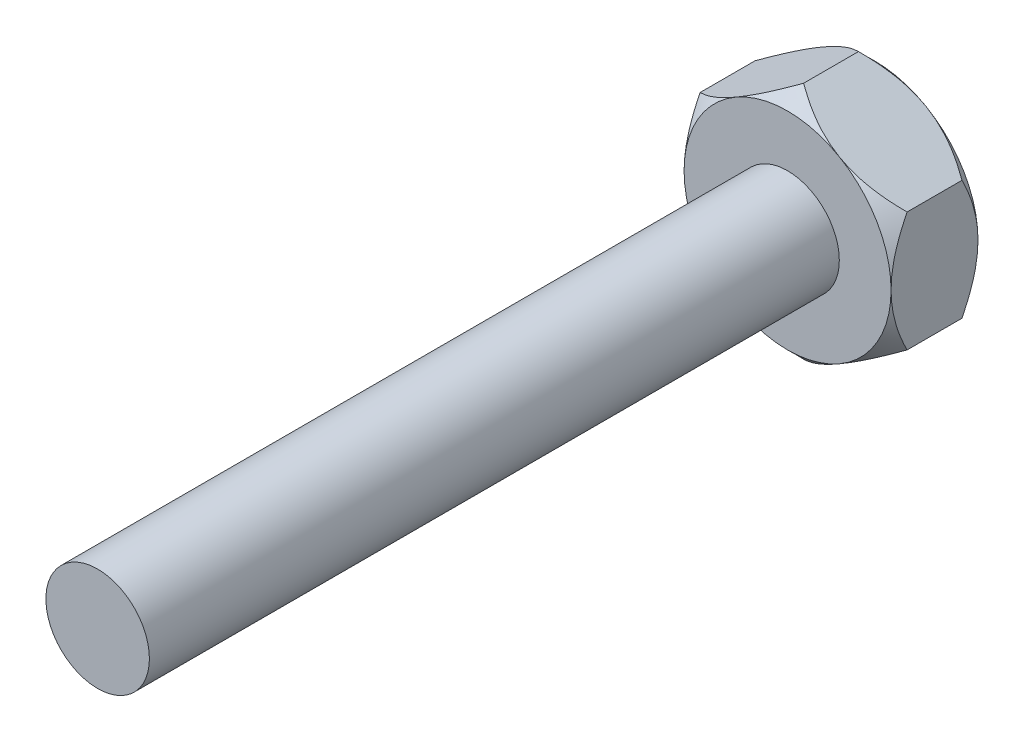
from build123d import *

# Parameters (mm, degrees)
SKETCH1_R           = 1.5
BOSS_EXTRUDE1_DEPTH = 20
BOSS_EXTRUDE3_DEPTH = 2.52
SKETCH7_OUTSIDE_W   = 60.826
SKETCH7_OUTSIDE_H   = 61.754
SKETCH7_OUTSIDE_R   = 3
CUT_EXTRUDE3_DEPTH  = 23.981523013
CUT_EXTRUDE3_DRAFT  = -45
SKETCH8_OUTSIDE_W   = 55.9
SKETCH8_OUTSIDE_H   = 56.828
SKETCH8_OUTSIDE_R   = 3
CUT_EXTRUDE5_DEPTH  = 21.518284529
CUT_EXTRUDE5_DRAFT  = -45


with BuildPart() as part:
    # Sketch1 → Boss-Extrude1 (new body)
    with BuildSketch(Plane.XY):
        Circle(SKETCH1_R)
    extrude(amount=BOSS_EXTRUDE1_DEPTH)

    # Sketch6 → Boss-Extrude3 (add)
    with BuildSketch(Plane(origin=(0, 0, 0), x_dir=(-1, 0, 0), z_dir=(0, 0, -1))):
        Polygon((0, -3.464101615), (3, -1.732050808), (3, 1.732050808), (0, 3.464101615), (-3, 1.732050808), (-3, -1.732050808), align=None)
    extrude(amount=BOSS_EXTRUDE3_DEPTH)


with BuildPart() as cut_extrude3_tool:
    # Sketch7 outside → Cut-Extrude3 (with draft: the straight prism first)
    with BuildSketch(Plane(origin=(0, 0, -2.52), x_dir=(-1, 0, 0), z_dir=(0, 0, -1))):
        Rectangle(SKETCH7_OUTSIDE_W, SKETCH7_OUTSIDE_H)
        Circle(SKETCH7_OUTSIDE_R, mode=Mode.SUBTRACT)
    extrude(amount=-CUT_EXTRUDE3_DEPTH)
    # Cut-Extrude3: the draft: its side faces are tilted about the plane it starts from
    cut_extrude3_sides = [cut_extrude3_tool.faces().sort_by_distance(p)[0] for p in [
        (0, -30.877, 9.470761507),
        (-30.413, 0, 9.470761507),
        (0, 30.877, 9.470761507),
        (30.413, 0, 9.470761507),
        (3, 0, 9.470761507),
    ]]
    draft(cut_extrude3_sides, Plane(origin=(0, 0, -2.52), x_dir=(-1, 0, 0), z_dir=(0, 0, -1)), CUT_EXTRUDE3_DRAFT)


with BuildPart() as part_1:
    add(part.part)

    # Cut-Extrude3: cut by cut_extrude3_tool
    add(cut_extrude3_tool.part, mode=Mode.SUBTRACT)


with BuildPart() as cut_extrude5_tool:
    # Sketch8 outside → Cut-Extrude5 (with draft: the straight prism first)
    with BuildSketch(Plane.XY):
        Rectangle(SKETCH8_OUTSIDE_W, SKETCH8_OUTSIDE_H)
        Circle(SKETCH8_OUTSIDE_R, mode=Mode.SUBTRACT)
    extrude(amount=-CUT_EXTRUDE5_DEPTH)
    # Cut-Extrude5: the draft: its side faces are tilted about the plane it starts from
    cut_extrude5_sides = [cut_extrude5_tool.faces().sort_by_distance(p)[0] for p in [
        (0, -28.414, -10.759142264),
        (27.95, 0, -10.759142264),
        (0, 28.414, -10.759142264),
        (-27.95, 0, -10.759142264),
        (-3, 0, -10.759142264),
    ]]
    draft(cut_extrude5_sides, Plane.XY, CUT_EXTRUDE5_DRAFT)


with BuildPart() as part_2:
    add(part_1.part)

    # Cut-Extrude5: cut by cut_extrude5_tool
    add(cut_extrude5_tool.part, mode=Mode.SUBTRACT)


solid = part_2.part
